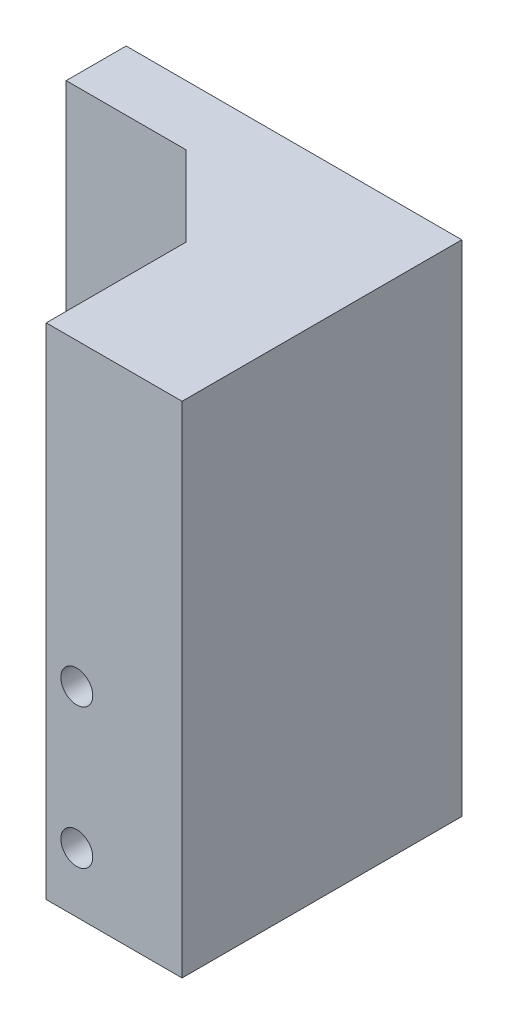
from build123d import *

# Parameters (mm, degrees)
CROQUIS1_W                = 16.8
CROQUIS1_H                = 20
CROQUIS1_R                = 2.5
SALIENTE_EXTRUIR1_DEPTH   = 3
CROQUIS2_W                = 6.8
CROQUIS2_H                = 20
SALIENTE_EXTRUIR2_DEPTH   = 11
SALIENTE_EXTRUIR3_DEPTH   = 5
SALIENTE_EXTRUIR4_DEPTH   = 2
TALADRO_ROSCADO_M21_D     = 1.6
TALADRO_ROSCADO_M21_DEPTH = 10
TALADRO_ROSCADO_M21_TIP   = 0.480688495
CROQUIS8_W                = 10
CROQUIS8_H                = 5
CORTAR_EXTRUIR1_DEPTH     = 10


with BuildPart() as part:
    # Croquis1 → Saliente-Extruir1 (new body)
    with BuildSketch(Plane.XY):
        with Locations((8.4, -10)):
            Rectangle(CROQUIS1_W, CROQUIS1_H)
        with Locations((5, -10)):
            Circle(CROQUIS1_R, mode=Mode.SUBTRACT)
    extrude(amount=SALIENTE_EXTRUIR1_DEPTH)

    # Croquis2 → Saliente-Extruir2 (add)
    with BuildSketch(Plane.XY.offset(3)):
        with Locations((13.4, -10)):
            Rectangle(CROQUIS2_W, CROQUIS2_H)
    extrude(amount=SALIENTE_EXTRUIR2_DEPTH)

    # Croquis3 → Saliente-Extruir3 (add)
    with BuildSketch(Plane.XZ.offset(20)):
        Polygon((0, 0), (16.8, 0), (16.8, 14), (10, 14), (10, 3), (0, 3), align=None)
    extrude(amount=SALIENTE_EXTRUIR3_DEPTH)

    # Croquis4 → Saliente-Extruir4 (add)
    with BuildSketch(Plane(origin=(0, 0, 0), x_dir=(1, 0, 0), z_dir=(0, 1, 0))):
        Polygon((6, -3), (10, -3), (10, -7), align=None)
    saliente_extruir4 = extrude(amount=-SALIENTE_EXTRUIR4_DEPTH)

    # Taladro roscado M21
    with Locations(Plane.XY.offset(14)):
        with Locations((11.529795897, -15), (11.529795897, -22)):
            Hole(TALADRO_ROSCADO_M21_D / 2, depth=TALADRO_ROSCADO_M21_DEPTH)
            with Locations((0, 0, -(TALADRO_ROSCADO_M21_DEPTH + TALADRO_ROSCADO_M21_TIP / 2))):  # 118° drill point
                Cone(0, TALADRO_ROSCADO_M21_D / 2, TALADRO_ROSCADO_M21_TIP, mode=Mode.SUBTRACT)

    # Croquis8 → Cortar-Extruir1 (cut)
    with BuildSketch(Plane.XY.offset(3)):
        with Locations((5, -22.5)):
            Rectangle(CROQUIS8_W, CROQUIS8_H)
    extrude(amount=-CORTAR_EXTRUIR1_DEPTH, mode=Mode.SUBTRACT)

    # Simetría1: Saliente-Extruir4 across plane
    add(saliente_extruir4.mirror(Plane.ZX.offset(-10)))


solid = part.part
